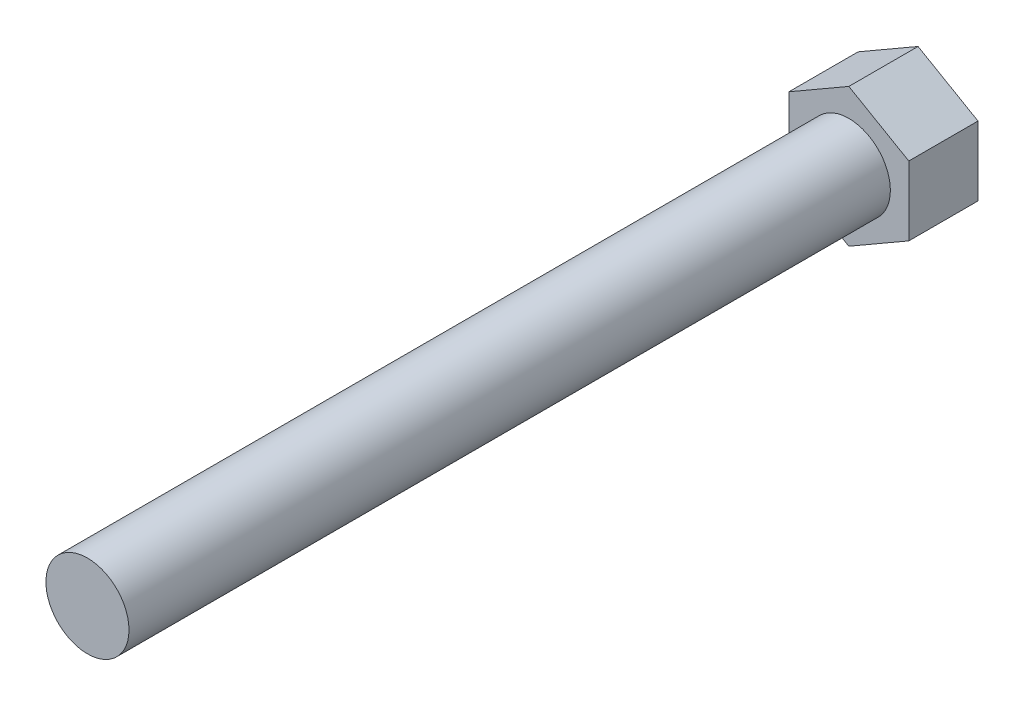
from build123d import *

# Parameters (mm, degrees)
BOSS_EXTRUDE1_DEPTH = 10
SKETCH2_R           = 6
BOSS_EXTRUDE2_DEPTH = 110


with BuildPart() as part:
    # Sketch1 → Boss-Extrude1 (new body)
    with BuildSketch(Plane.XY):
        Polygon((0, 10), (-8.660254038, 5), (-8.660254038, -5), (0, -10), (8.660254038, -5), (8.660254038, 5), align=None)
    extrude(amount=BOSS_EXTRUDE1_DEPTH)

    # Sketch2 → Boss-Extrude2 (add)
    with BuildSketch(Plane.XY.offset(10)):
        Circle(SKETCH2_R)
    extrude(amount=BOSS_EXTRUDE2_DEPTH)


solid = part.part
